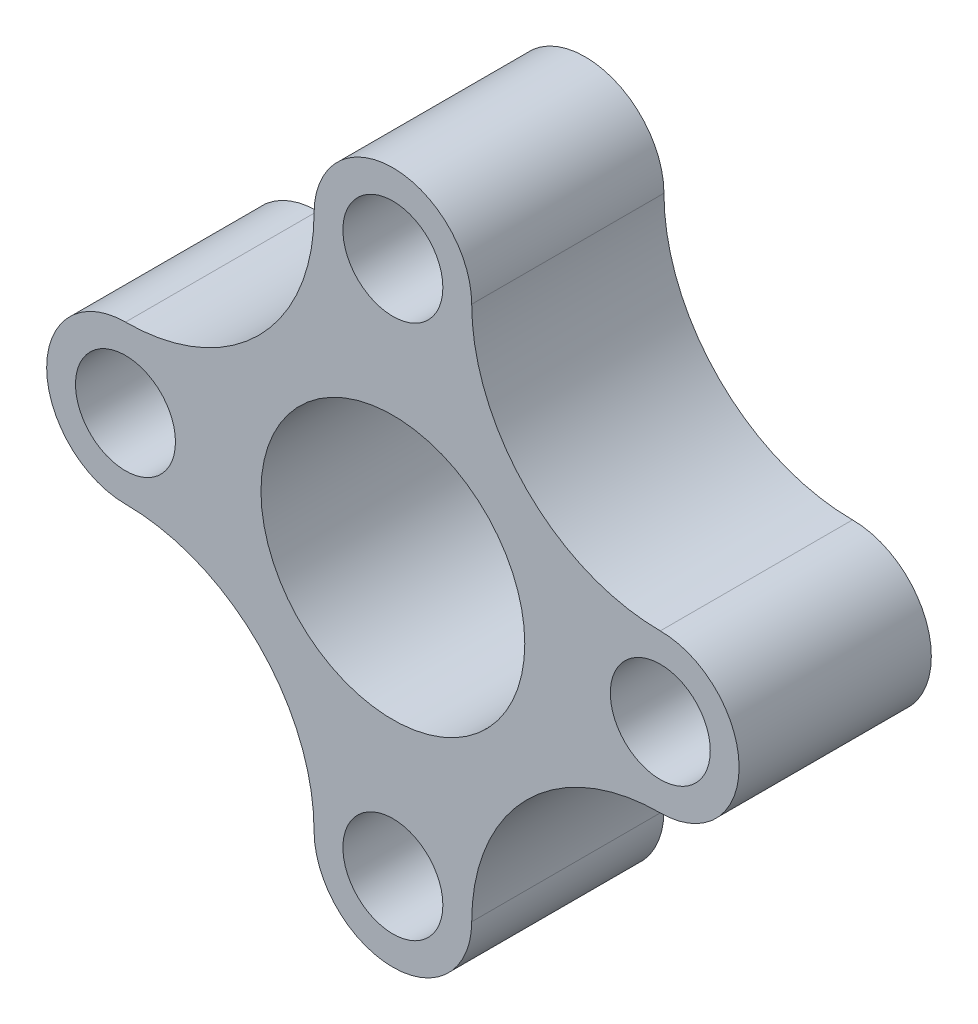
from build123d import *

# Parameters (mm, degrees)
AUFSATZ_LINEAR_AUSTRAGEN1_DEPTH = 10
SKIZZE2_R                       = 2.6
SCHNITT_LINEAR_AUSTRAGEN2_DEPTH = 10
SKIZZE3_R                       = 6.861789019
SCHNITT_LINEAR_AUSTRAGEN4_DEPTH = 10


with BuildPart() as part:
    # Skizze1 → Aufsatz-Linear austragen1 (new body)
    with BuildSketch(Plane.XY):
        with BuildLine():
            Line((0, 18.010189193), (0, 0))
            Line((0, 0), (18.010189193, 0))
            ThreePointArc((18.010189193, 0), (16.809326996, 2.899137803), (13.910189193, 4.1))
            ThreePointArc((13.910189193, 4.1), (6.97333789, 6.97333789), (4.1, 13.910189193))
            ThreePointArc((4.1, 13.910189193), (2.899137803, 16.809326996), (0, 18.010189193))
        make_face()
    extrude(amount=AUFSATZ_LINEAR_AUSTRAGEN1_DEPTH)

    # Spiegeln1: part across plane


with BuildPart() as part_1:
    add(part.part)
    add(part.part.mirror(Plane.ZX))

    # Spiegeln2: part across plane


with BuildPart() as part_2:
    add(part_1.part)
    add(part_1.part.mirror(Plane(origin=(0, 0, 0), x_dir=(0, 0, 1), z_dir=(1, 0, 0))))

    # Skizze2 → Schnitt-Linear austragen2 (cut)
    with BuildSketch(Plane.XY):
        with Locations((0, 13.910189193)):
            Circle(SKIZZE2_R)
        with Locations((13.910189193, 0)):
            Circle(SKIZZE2_R)
        with Locations((0, -13.910189193)):
            Circle(SKIZZE2_R)
        with Locations((-13.910189193, 0)):
            Circle(SKIZZE2_R)
    extrude(amount=SCHNITT_LINEAR_AUSTRAGEN2_DEPTH, mode=Mode.SUBTRACT)

    # Skizze3 → Schnitt-Linear austragen4 (cut)
    with BuildSketch(Plane.XY):
        Circle(SKIZZE3_R)
    extrude(amount=SCHNITT_LINEAR_AUSTRAGEN4_DEPTH, mode=Mode.SUBTRACT)


solid = part_2.part
